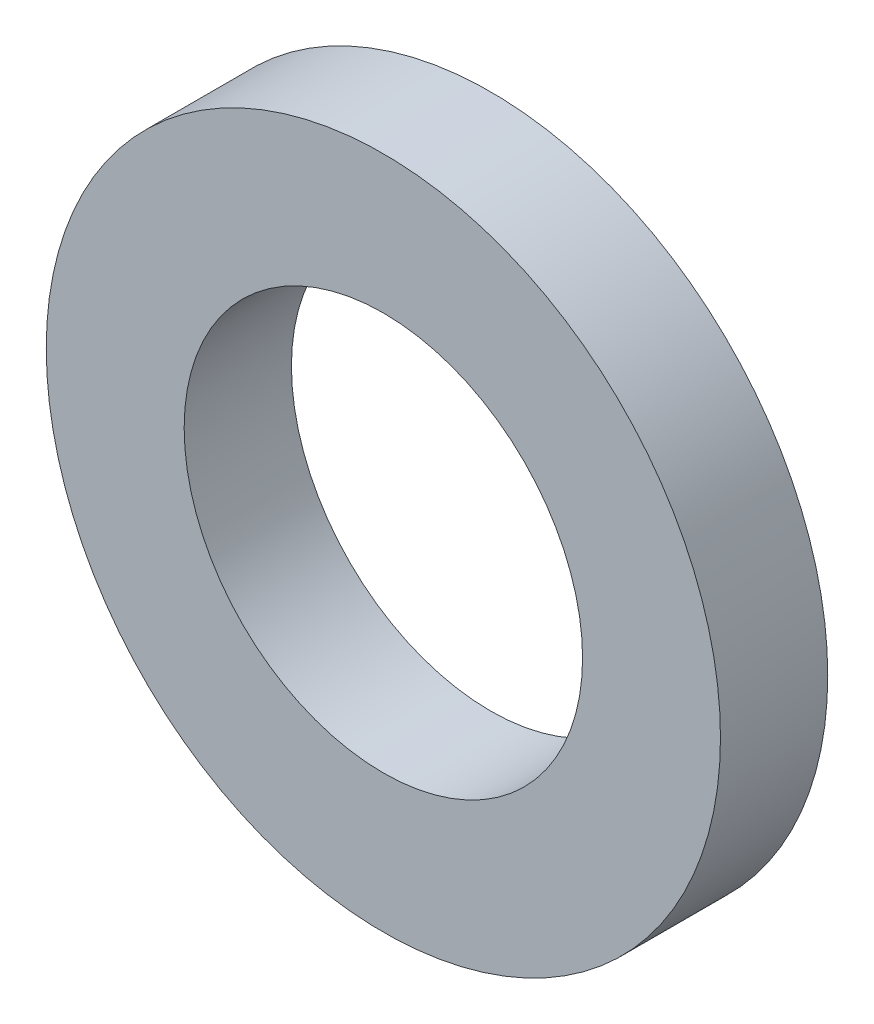
from build123d import *

# Parameters (mm, degrees)
SKETCH1_R           = 11
BOSS_EXTRUDE1_DEPTH = 3.5
SKETCH4_R           = 6.5
CUT_EXTRUDE2_DEPTH  = 3.5


with BuildPart() as part:
    # Sketch1 → Boss-Extrude1 (new body)
    with BuildSketch(Plane.XY):
        Circle(SKETCH1_R)
    extrude(amount=BOSS_EXTRUDE1_DEPTH)

    # Sketch4 → Cut-Extrude2 (cut)
    with BuildSketch(Plane(origin=(0, 0, 0), x_dir=(-1, 0, 0), z_dir=(0, 0, -1))):
        Circle(SKETCH4_R)
    extrude(amount=-CUT_EXTRUDE2_DEPTH, mode=Mode.SUBTRACT)


solid = part.part
